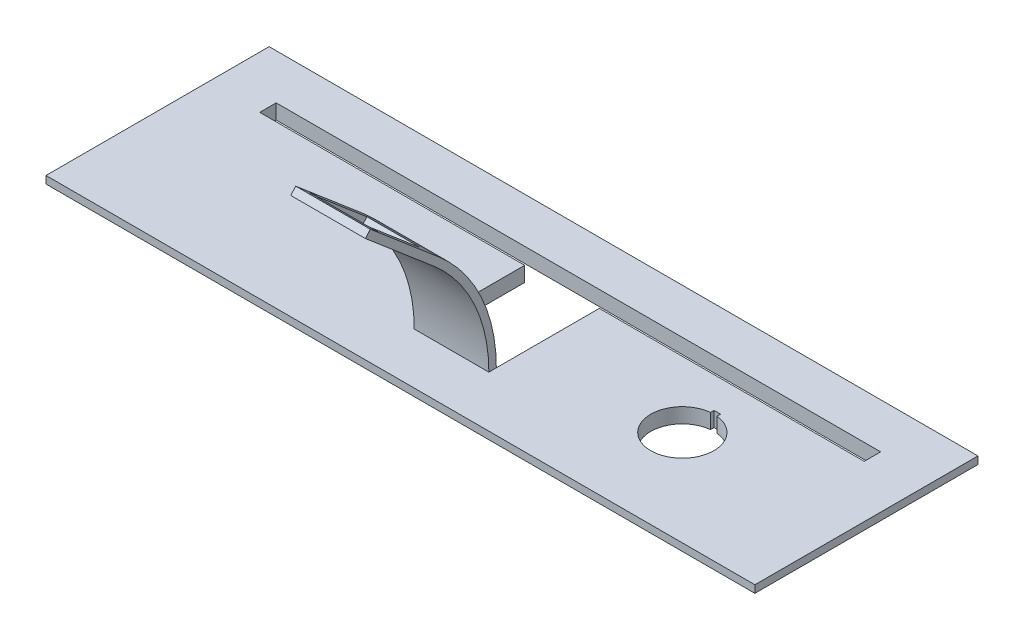
from build123d import *

# Parameters (mm, degrees)
SKETCH1_W                = 234.95
SKETCH1_H                = 69.596
BOSS_EXTRUDE1_DEPTH      = 2.54
SKETCH2_W                = 241.3
SKETCH2_H                = 75.946
BOSS_EXTRUDE2_DEPTH      = 2.54
SKETCH3_W                = 25.4
SKETCH3_H                = 4.572
SKETCH3_H_2              = 30.48
CUT_EXTRUDE2_DEPTH       = 127.5866408
BOSS_EXTRUDE7_DEPTH      = 12.7
BOSS_EXTRUDE7_DEPTH_BACK = 12.7
SKETCH5_W                = 25.4
SKETCH5_H                = 2.54
BOSS_EXTRUDE8_DEPTH      = 30.48
CUT_EXTRUDE3_REACH       = 153.329
SKETCH6_W                = 18.288
SKETCH6_H                = 23.01875
CUT_EXTRUDE4_REACH       = 153.329
SKETCH9_R                = 1
CUT_EXTRUDE6_REACH       = 151.523


with BuildPart() as part:
    # Sketch1 → Boss-Extrude1 (new body)
    with BuildSketch(Plane(origin=(0, 0, 0), x_dir=(1, 0, 0), z_dir=(0, 1, 0))):
        Rectangle(SKETCH1_W, SKETCH1_H)
    extrude(amount=BOSS_EXTRUDE1_DEPTH)

    # Sketch2 → Boss-Extrude2 (add)
    with BuildSketch(Plane(origin=(0, 2.54, 0), x_dir=(1, 0, 0), z_dir=(0, 1, 0))):
        Rectangle(SKETCH2_W, SKETCH2_H)
    extrude(amount=BOSS_EXTRUDE2_DEPTH)

    # Sketch3 → Cut-Extrude2 (cut, through all)
    with BuildSketch(Plane(origin=(0, 5.08, 0), x_dir=(1, 0, 0), z_dir=(0, 1, 0))):
        Polygon((102.87, 22.606), (-102.87, 22.606), (-102.87, 17.018), (-12.7, 17.018), (12.7, 17.018), (102.87, 17.018), align=None)
        with Locations((0, 14.732)):
            Rectangle(SKETCH3_W, SKETCH3_H)
        with Locations((0, -2.794)):
            Rectangle(SKETCH3_W, SKETCH3_H_2)
    extrude(amount=-CUT_EXTRUDE2_DEPTH, mode=Mode.SUBTRACT)

    # Sketch4 → Boss-Extrude7 (add, two sides: drawn at the far end of the back side and taken through both)
    with BuildSketch(Plane(origin=(0, 0, 0), x_dir=(0, 0, -1), z_dir=(1, 0, 0)).offset(-BOSS_EXTRUDE7_DEPTH_BACK)):
        with BuildLine():
            Line((-20.574, 5.08), (-18.034, 5.08))
            ThreePointArc((-18.034, 5.08), (-23.194025065, 28.533326897), (-37.721134665, 47.655238095))
            Line((-37.721134665, 47.655238095), (-39.366264908, 45.72))
            ThreePointArc((-39.366264908, 45.72), (-25.499478471, 27.467266584), (-20.574, 5.08))
        make_face()
    extrude(amount=BOSS_EXTRUDE7_DEPTH + BOSS_EXTRUDE7_DEPTH_BACK)

    # Sketch5 → Boss-Extrude8 (add)
    with BuildSketch(Plane(origin=(0, 38.605953422, 45.413858329), x_dir=(1, 0, 0), z_dir=(0, 0.6476890718445453, 0.7619047619047618))):
        with Locations((0, 10.607186134)):
            Rectangle(SKETCH5_W, SKETCH5_H)
    extrude(amount=BOSS_EXTRUDE8_DEPTH)

    # Sketch6 → Cut-Extrude3 (cut, up to next)
    with BuildSketch(Plane(origin=(0, 9.049284674, -7.692723663), x_dir=(1, 0, 0), z_dir=(0, 0.7619047619047616, -0.6476890718445452)), mode=Mode.PRIVATE) as cut_extrude3_sk1:
        with Locations((0, -74.455715595)):
            Rectangle(SKETCH6_W, SKETCH6_H)
    cut_extrude3_tool1 = extrude(cut_extrude3_sk1.sketch, amount=-CUT_EXTRUDE3_REACH, mode=Mode.PRIVATE) & part.part
    add(cut_extrude3_tool1.solids().sort_by_distance((0, 57.273438, 49.035441))[0], mode=Mode.SUBTRACT)

    # Sketch9 → Cut-Extrude4 (cut, up to next)
    with BuildSketch(Plane(origin=(0, 9.049284674, -7.692723663), x_dir=(1, 0, 0), z_dir=(0, 0.7619047619047616, -0.6476890718445452)), mode=Mode.PRIVATE) as cut_extrude4_sk1:
        with Locations(Location((-10.31875, -85.171340595, 0), (0, 0, 270))):
            Circle(SKETCH9_R)
    cut_extrude4_tool1 = extrude(cut_extrude4_sk1.sketch, amount=-CUT_EXTRUDE4_REACH, mode=Mode.PRIVATE) & part.part
    # Sketch9 → Cut-Extrude4 (cut, up to next)
    with BuildSketch(Plane(origin=(0, 9.049284674, -7.692723663), x_dir=(1, 0, 0), z_dir=(0, 0.7619047619047616, -0.6476890718445452)), mode=Mode.PRIVATE) as cut_extrude4_sk2:
        with Locations(Location((10.31875, -85.171340595, 0), (0, 0, 270))):
            Circle(SKETCH9_R)
    cut_extrude4_tool2 = extrude(cut_extrude4_sk2.sketch, amount=-CUT_EXTRUDE4_REACH, mode=Mode.PRIVATE) & part.part
    add(cut_extrude4_tool1.solids().sort_by_distance((-10.31875, 64.213831, 57.199726))[0], mode=Mode.SUBTRACT)
    add(cut_extrude4_tool2.solids().sort_by_distance((10.31875, 64.213831, 57.199726))[0], mode=Mode.SUBTRACT)

    # Sketch10 → Cut-Extrude6 (cut, up to next)
    with BuildSketch(Plane(origin=(0, 5.08, 0), x_dir=(1, 0, 0), z_dir=(0, 1, 0)), mode=Mode.PRIVATE) as cut_extrude6_sk1:
        with BuildLine():
            Line((62.300670098, 6.472268969), (64.500670098, 6.472268969))
            Line((64.500670098, 6.472268969), (64.500670098, 5.272268969))
            ThreePointArc((64.500670098, 5.272268969), (63.400670098, -16.171303867), (62.300670098, 5.272268969))
            Line((62.300670098, 5.272268969), (62.300670098, 6.472268969))
        make_face()
    cut_extrude6_tool1 = extrude(cut_extrude6_sk1.sketch, amount=-CUT_EXTRUDE6_REACH, mode=Mode.PRIVATE) & part.part
    add(cut_extrude6_tool1.solids().sort_by_distance((63.40067, 5.08, 5.342182))[0], mode=Mode.SUBTRACT)


solid = part.part
